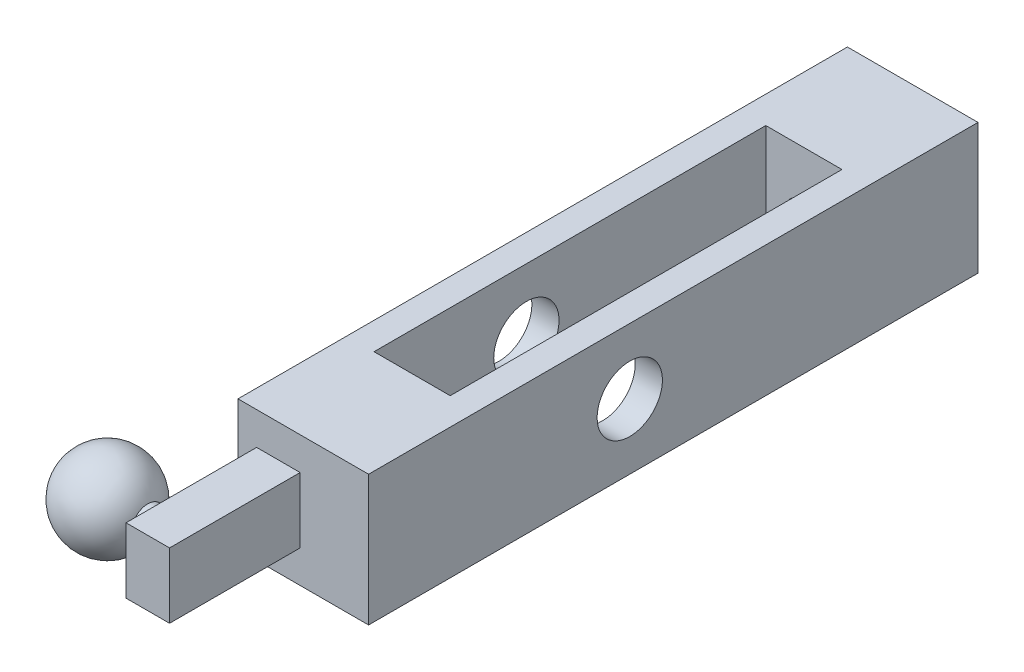
from build123d import *

# Parameters (mm, degrees)
SKETCH_1_W          = 6
SKETCH_1_H          = 6
EXTRUDE_1_DEPTH     = 28
SKETCH_2_W          = 2
SKETCH_2_H          = 3
EXTRUDE_2_DEPTH     = 6
SKETCH_3_R          = 0.75
EXTRUDE_3_DEPTH     = 1
SKETCH_5_W          = 18
SKETCH_5_H          = 3.5
CUT_EXTRUDE_1_DEPTH = 8
SKETCH_6_R          = 1.5
CUT_EXTRUDE_2_DEPTH = 8
SKETCH_7_R          = 0.9
CUT_EXTRUDE_3_DEPTH = 8


with BuildPart() as part:
    # 草图1 → 凸台-拉伸1 (new body)
    with BuildSketch(Plane.XY):
        Rectangle(SKETCH_1_W, SKETCH_1_H)
    extrude(amount=EXTRUDE_1_DEPTH)

    # 草图2 → 凸台-拉伸2 (add)
    with BuildSketch(Plane.XY.offset(28)):
        with Locations((-1.14479355, -0.004540815)):
            Rectangle(SKETCH_2_W, SKETCH_2_H)
    extrude(amount=EXTRUDE_2_DEPTH)

    # 草图3 → 凸台-拉伸3 (add)
    with BuildSketch(Plane.ZY.offset(2.14479355)):
        with Locations(Location((32, 0, 0), (0, 0, 90))):
            Circle(SKETCH_3_R)
    extrude(amount=EXTRUDE_3_DEPTH)

    # 草图4 → 旋转1 (revolve)
    with BuildSketch(Plane(origin=(0, 0, 0), x_dir=(1, 0, 0), z_dir=(0, 1, 0))):
        with BuildLine():
            Line((-3.14479355, -32), (-6.998843172, -32))
            ThreePointArc((-6.998843172, -32), (-5.380877697, -30.036826645), (-3.14479355, -31.25))
            Line((-3.14479355, -31.25), (-3.14479355, -32))
        make_face()
    revolve(axis=Axis((-3.14479355, 0, 32), (-1, 0, 0)))

    # 草图5 → 切除-拉伸1 (cut)
    with BuildSketch(Plane(origin=(0.5, 3, 0), x_dir=(0, 0, 1), z_dir=(0, -1, 0))):
        with Locations((14, 0.5)):
            Rectangle(SKETCH_5_W, SKETCH_5_H)
    extrude(amount=CUT_EXTRUDE_1_DEPTH, mode=Mode.SUBTRACT)

    # 草图6 → 切除-拉伸2 (cut)
    with BuildSketch(Plane.ZY.offset(3)):
        with Locations((16, 0)):
            Circle(SKETCH_6_R)
    extrude(amount=-CUT_EXTRUDE_2_DEPTH, mode=Mode.SUBTRACT)

    # 草图7 → 切除-拉伸3 (cut)
    with BuildSketch(Plane(origin=(0, 0, 0), x_dir=(-1, 0, 0), z_dir=(0, 0, -1))):
        Circle(SKETCH_7_R)
    extrude(amount=-CUT_EXTRUDE_3_DEPTH, mode=Mode.SUBTRACT)


solid = part.part
